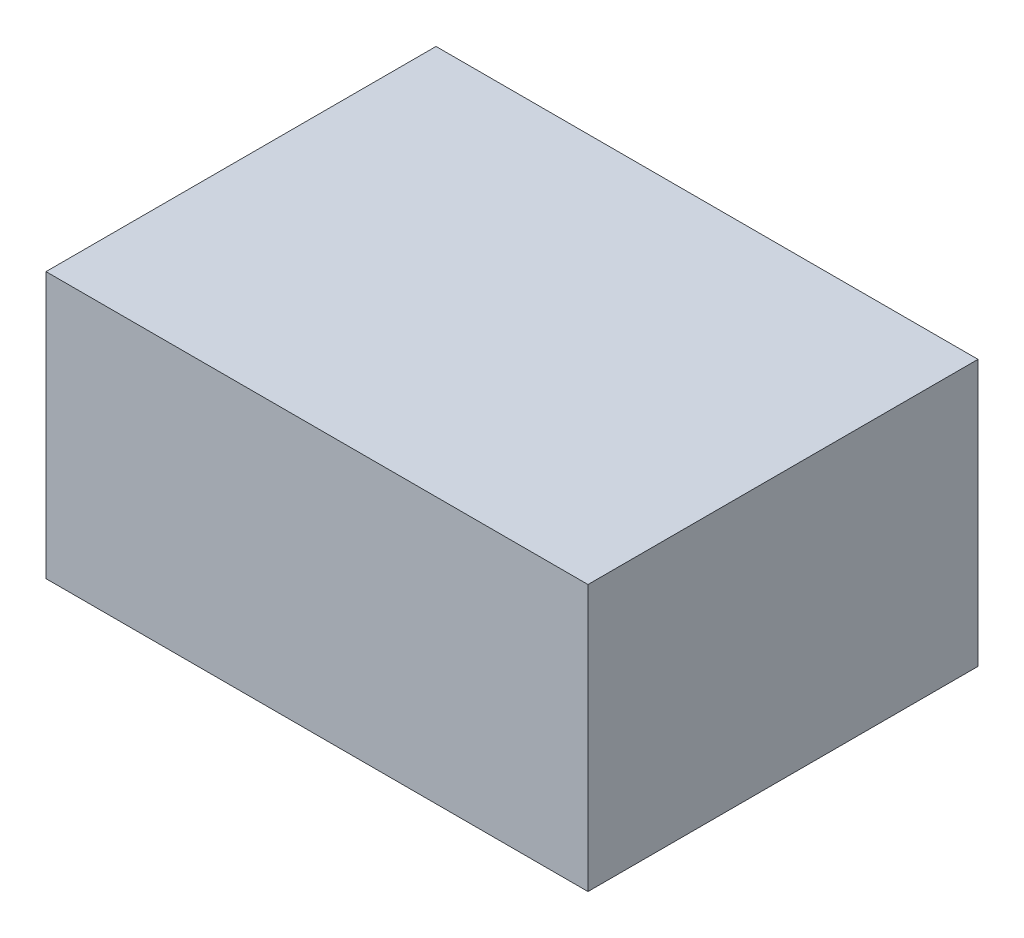
from build123d import *

# Parameters (mm, degrees)
SKETCH_1_W      = 85.6
SKETCH_1_H      = 61.6
EXTRUDE_1_DEPTH = 42


with BuildPart() as part:
    # 草图1 → 凸台-拉伸1 (new body)
    with BuildSketch(Plane(origin=(0, 0, 0), x_dir=(1, 0, 0), z_dir=(0, 1, 0))):
        Rectangle(SKETCH_1_W, SKETCH_1_H)
    extrude(amount=EXTRUDE_1_DEPTH)


solid = part.part
